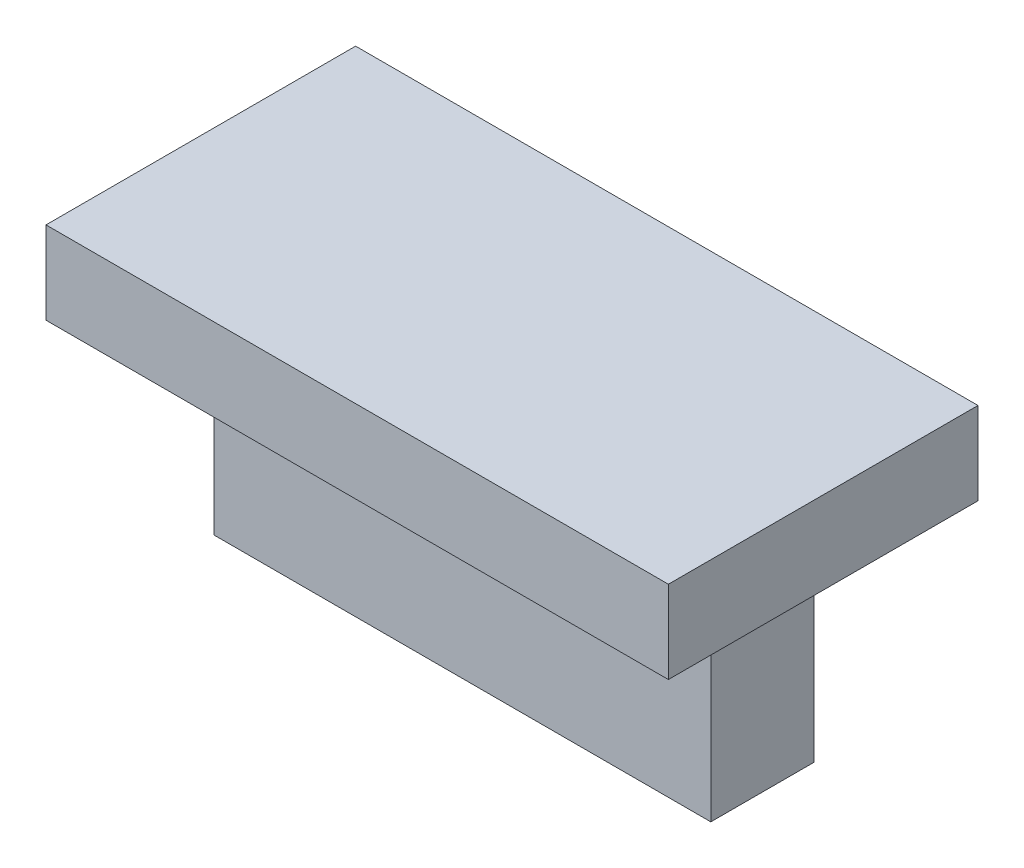
from build123d import *

# Parameters (mm, degrees)
SKETCH2_W           = 61.111815401
SKETCH2_H           = 25.256192137
SKETCH2_R           = 3.313116642
BOSS_EXTRUDE6_DEPTH = 6.35
SKETCH2_5_W         = 76.588209157
SKETCH2_5_H         = 10.16
BOSS_EXTRUDE7_DEPTH = 19.05


with BuildPart() as part:
    # Sketch2 → Boss-Extrude6 (new, symmetric)
    with BuildSketch(Plane.XY):
        with Locations((16.884167922, -7.961511284)):
            Rectangle(SKETCH2_W, SKETCH2_H)
        Circle(SKETCH2_R, mode=Mode.SUBTRACT)
        with Locations((38.1, 0)):
            Circle(SKETCH2_R, mode=Mode.SUBTRACT)
    extrude(amount=BOSS_EXTRUDE6_DEPTH, both=True)

    # Sketch2<5> → Boss-Extrude7 (add, symmetric)
    with BuildSketch(Plane.XY):
        with Locations((16.624239124, 9.746584785)):
            Rectangle(SKETCH2_5_W, SKETCH2_5_H)
    extrude(amount=BOSS_EXTRUDE7_DEPTH, both=True)


solid = part.part
